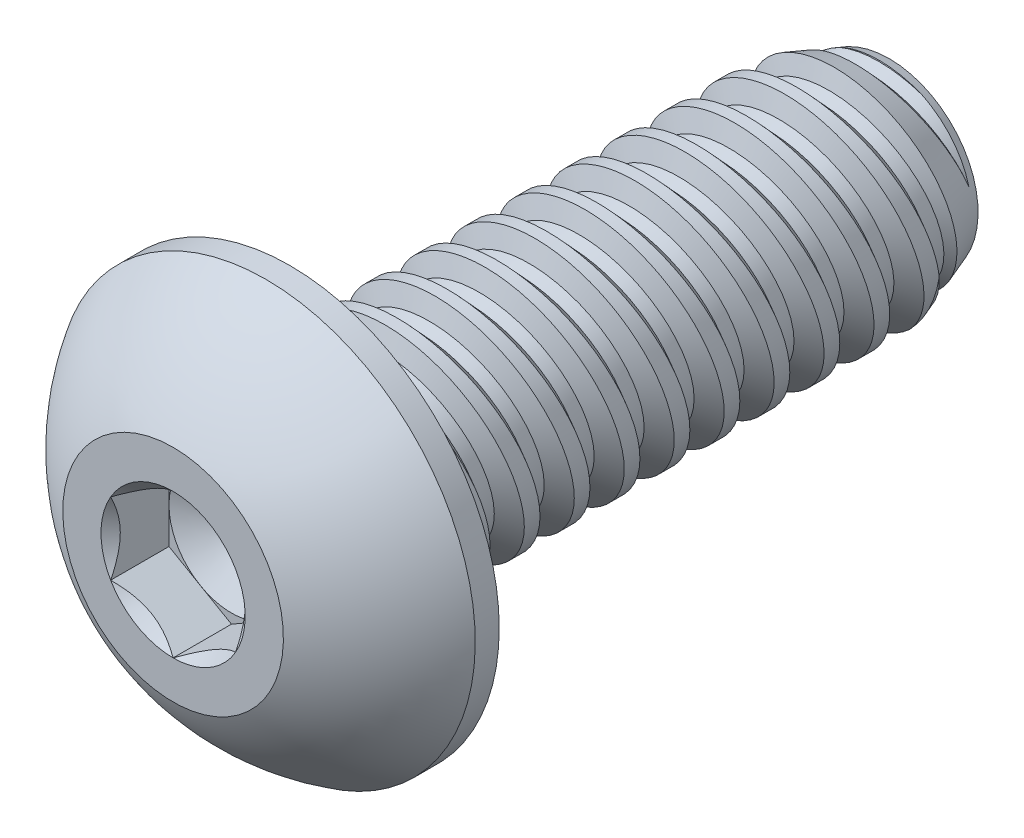
from build123d import *

# Parameters (mm, degrees)
SKETCH1_W          = 9.525
SKETCH1_H          = 1.7526
LPATTERN1_COUNT    = 12
LPATTERN1_PITCH    = 0.79375
LPATTERN2_COUNT    = 2
LPATTERN2_PITCH    = 0.79375
SKETCH4_R          = 3.3274
EXTRUDE1_DEPTH     = 1.8542
CUT_EXTRUDE1_DEPTH = 0.9271
SKETCH7_R          = 1.14567944
CUT_EXTRUDE4_DEPTH = 0.9271
CUT_EXTRUDE4_DRAFT = -45
SKETCH8_R          = 0.9921875
CUT_EXTRUDE5_DEPTH = 0.309033333
CUT_EXTRUDE5_DRAFT = -60


with BuildPart() as part:
    # Sketch1 → Revolve1 (revolve)
    with BuildSketch(Plane(origin=(0, 0, 0), x_dir=(0, 0, -1), z_dir=(1, 0, 0)), mode=Mode.PRIVATE) as revolve1_sk:
        with Locations((4.7625, 0.8763)):
            Rectangle(SKETCH1_W, SKETCH1_H)
    revolve(revolve1_sk.sketch.rotate(Axis((0, 0, 0), (0, 0, 1)), 143.8064327), axis=Axis((0, 0, 0), (0, 0, 1)))

    # Sketch2 → Cut-Revolve1 (revolve, cut)
    with BuildSketch(Plane(origin=(0, 0, 0), x_dir=(0, 0, -1), z_dir=(1, 0, 0)), mode=Mode.PRIVATE) as cut_revolve1_sk:
        Polygon((0.096768654, 1.774513192), (0.774149232, 1.927905533), (0.6271145, 1.454101991), (0.433577192, 1.410275607), align=None)
    cut_revolve1 = revolve(cut_revolve1_sk.sketch.rotate(Axis((0, -0.193538035, 0), (0, 0.2208573637991382, -0.9753061185369931)), 180), axis=Axis((0, -0.193538035, 0), (0, 0.2208573637991382, -0.9753061185369931)), mode=Mode.SUBTRACT)

    # Sketch3 → Cut-Revolve2 (revolve, cut)
    with BuildSketch(Plane(origin=(0, 0, 0), x_dir=(0, 0, -1), z_dir=(1, 0, 0)), mode=Mode.PRIVATE) as cut_revolve2_sk:
        Polygon((9.525, 1.410275607), (8.584471461, 1.7526), (9.525, 1.7526), align=None)
    revolve(cut_revolve2_sk.sketch.rotate(Axis((0, 0, -8.584471461), (0, 0, 1)), 143.8064327), axis=Axis((0, 0, -8.584471461), (0, 0, 1)), mode=Mode.SUBTRACT)

    # LPattern1: Cut-Revolve1 ×12
    with Locations(*[(0, 0, -i * LPATTERN1_PITCH) for i in range(1, LPATTERN1_COUNT)]):
        add(cut_revolve1, mode=Mode.SUBTRACT)

    # LPattern2: Cut-Revolve1 ×2
    with Locations(*[(0, 0, i * LPATTERN2_PITCH) for i in range(1, LPATTERN2_COUNT)]):
        add(cut_revolve1, mode=Mode.SUBTRACT)

    # Sketch4 → Extrude1 (add)
    with BuildSketch(Plane.XY):
        with Locations(Location((0, 0, 0), (0, 0, 90))):
            Circle(SKETCH4_R)
    extrude(amount=EXTRUDE1_DEPTH)

    # Sketch9 → Cut-Revolve3 (revolve, cut)
    with BuildSketch(Plane(origin=(0, 0, 0), x_dir=(0, 0, -1), z_dir=(1, 0, 0))):
        with BuildLine():
            Line((0, 3.3274), (-0.381, 3.3274))
            ThreePointArc((-0.381, 3.3274), (-1.229468441, 2.644651123), (-1.8542, 1.7526))
            Line((-1.8542, 1.7526), (-2.2352, 1.7526))
            Line((-2.2352, 1.7526), (-2.2352, 3.7084))
            Line((-2.2352, 3.7084), (0, 3.7084))
            Line((0, 3.7084), (0, 3.3274))
        make_face()
    revolve(axis=Axis((0, 0, 0), (0, 0, 1)), mode=Mode.SUBTRACT)

    # Sketch6 → Cut-Extrude1 (cut)
    with BuildSketch(Plane.XY.offset(1.8542)):
        Polygon((0, -1.14567944), (0.9921875, -0.57283972), (0.9921875, 0.57283972), (0, 1.14567944), (-0.9921875, 0.57283972), (-0.9921875, -0.57283972), align=None)
    extrude(amount=-CUT_EXTRUDE1_DEPTH, mode=Mode.SUBTRACT)


with BuildPart() as cut_extrude4_tool:
    # Sketch7 → Cut-Extrude4 (with draft: the straight prism first)
    with BuildSketch(Plane.XY.offset(1.8542)):
        Circle(SKETCH7_R)
    extrude(amount=-CUT_EXTRUDE4_DEPTH)
    # Cut-Extrude4: the draft: its side faces are tilted about the plane it starts from
    cut_extrude4_sides = [cut_extrude4_tool.faces().sort_by_distance(p)[0] for p in [
        (-1.14567944, 0, 1.39065),
    ]]
    draft(cut_extrude4_sides, Plane.XY.offset(1.8542), CUT_EXTRUDE4_DRAFT)


with BuildPart() as part_1:
    add(part.part)

    # Cut-Extrude4: cut by cut_extrude4_tool
    add(cut_extrude4_tool.part, mode=Mode.SUBTRACT)


with BuildPart() as cut_extrude5_tool:
    # Sketch8 → Cut-Extrude5 (with draft: the straight prism first)
    with BuildSketch(Plane.XY.offset(0.9271)):
        Circle(SKETCH8_R)
    extrude(amount=-CUT_EXTRUDE5_DEPTH)
    # Cut-Extrude5: the draft: its side faces are tilted about the plane it starts from
    cut_extrude5_sides = [cut_extrude5_tool.faces().sort_by_distance(p)[0] for p in [
        (-0.9921875, 0, 0.772583333),
    ]]
    draft(cut_extrude5_sides, Plane.XY.offset(0.9271), CUT_EXTRUDE5_DRAFT)


with BuildPart() as part_2:
    add(part_1.part)

    # Cut-Extrude5: cut by cut_extrude5_tool
    add(cut_extrude5_tool.part, mode=Mode.SUBTRACT)


solid = part_2.part
